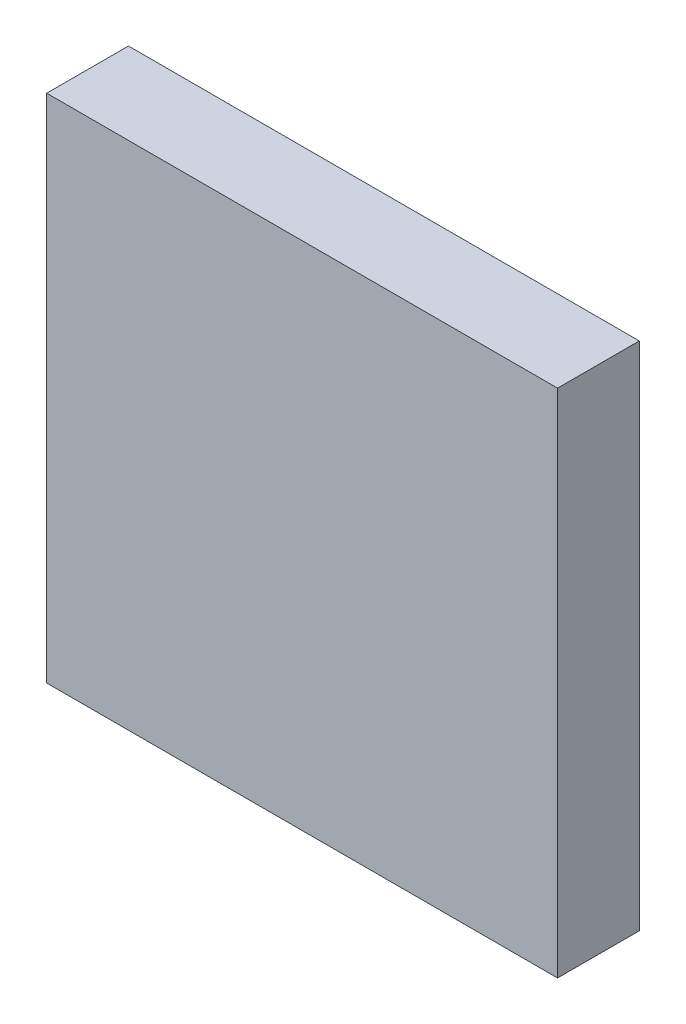
from build123d import *

# Parameters (mm, degrees)
SKETCH_1_W            = 50
SKETCH_1_H            = 50
EXTRUDE_1_DEPTH       = 8
HOLE_WIZARD_M63_D     = 5
HOLE_WIZARD_M63_DEPTH = 14
HOLE_WIZARD_M63_TIP   = 1.502151548


with BuildPart() as part:
    # Эскиз1 → Бобышка-Вытянуть1 (new body)
    with BuildSketch(Plane.XY):
        with Locations((25, 25)):
            Rectangle(SKETCH_1_W, SKETCH_1_H)
    extrude(amount=EXTRUDE_1_DEPTH)

    # Отверстие обработанное метчиком M63
    with Locations(Plane(origin=(0, 0, 0), x_dir=(-1, 0, 0), z_dir=(0, -1, 0))):
        with Locations((-25, -4)):
            Hole(HOLE_WIZARD_M63_D / 2, depth=HOLE_WIZARD_M63_DEPTH)
            with Locations((0, 0, -(HOLE_WIZARD_M63_DEPTH + HOLE_WIZARD_M63_TIP / 2))):  # 118° drill point
                Cone(0, HOLE_WIZARD_M63_D / 2, HOLE_WIZARD_M63_TIP, mode=Mode.SUBTRACT)


solid = part.part
